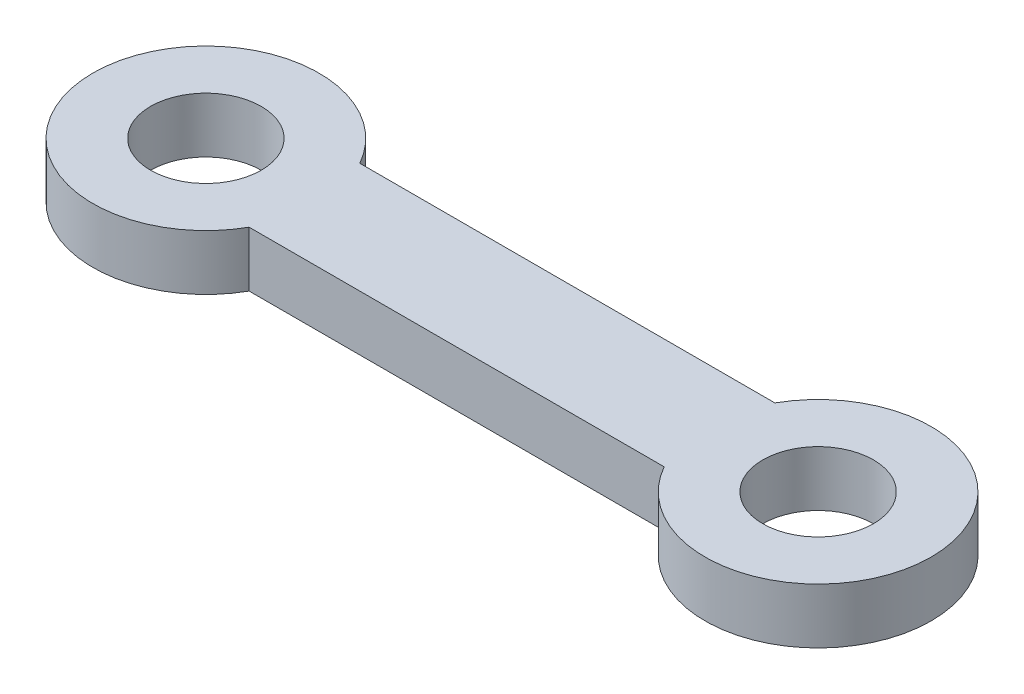
from build123d import *

# Parameters (mm, degrees)
SKETCH4_R           = 40.863144044
SKETCH4_W           = 150
SKETCH4_H           = 40
BOSS_EXTRUDE1_DEPTH = 20
CUT_EXTRUDE1_REACH  = 160.181
SKETCH6_R           = 20


with BuildPart() as part:
    # Sketch4 → Boss-Extrude1 (new body)
    with BuildSketch(Plane(origin=(0, 0, 0), x_dir=(1, 0, 0), z_dir=(0, 1, 0))):
        with Locations((-110.634204652, 0)):
            Circle(SKETCH4_R)
        with Locations((110.634204652, 0)):
            Circle(SKETCH4_R)
        Rectangle(SKETCH4_W, SKETCH4_H)
    extrude(amount=BOSS_EXTRUDE1_DEPTH)

    # Sketch6 → Cut-Extrude1 (cut, up to next)
    with BuildSketch(Plane.XZ, mode=Mode.PRIVATE) as cut_extrude1_sk1:
        with Locations(Location((-110.634204652, 0, 0), (0, 0, 270))):
            Circle(SKETCH6_R)
    cut_extrude1_tool1 = extrude(cut_extrude1_sk1.sketch, amount=-CUT_EXTRUDE1_REACH, mode=Mode.PRIVATE) & part.part
    # Sketch6 → Cut-Extrude1 (cut, up to next)
    with BuildSketch(Plane.XZ, mode=Mode.PRIVATE) as cut_extrude1_sk2:
        with Locations(Location((110.634204652, 0, 0), (0, 0, 270))):
            Circle(SKETCH6_R)
    cut_extrude1_tool2 = extrude(cut_extrude1_sk2.sketch, amount=-CUT_EXTRUDE1_REACH, mode=Mode.PRIVATE) & part.part
    add(cut_extrude1_tool1.solids().sort_by_distance((-110.634205, 0, 0))[0], mode=Mode.SUBTRACT)
    add(cut_extrude1_tool2.solids().sort_by_distance((110.634205, 0, 0))[0], mode=Mode.SUBTRACT)


solid = part.part
